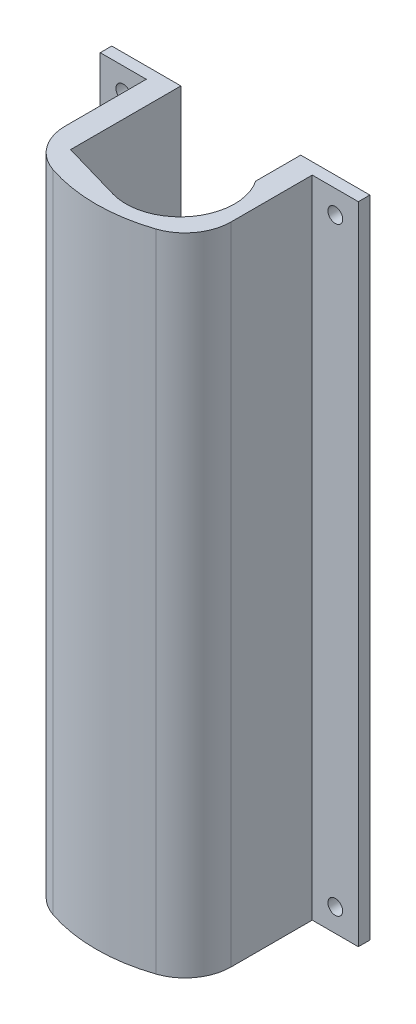
from build123d import *

# Parameters (mm, degrees)
BOSS_EXTRUDE1_DEPTH = 177.8
SKETCH2_R           = 2.032
CUT_EXTRUDE1_DEPTH  = 186.827403736
FILLET2_R           = 12.7


with BuildPart() as part:
    # Sketch1 → Boss-Extrude1 (new body)
    with BuildSketch(Plane(origin=(0, 0, 0), x_dir=(1, 0, 0), z_dir=(0, 1, 0))):
        with BuildLine():
            Line((-20.574, -9.652129604), (-4.162019583, -14.39674322))
            ThreePointArc((-4.162019583, -14.39674322), (12.103082443, -8.837647749), (12.446, 8.347796497))
            Line((12.446, 8.347796497), (12.446, 20.746712887))
            Line((12.446, 20.746712887), (31.496, 20.746712887))
            Line((31.496, 20.746712887), (31.496, 17.571712887))
            Line((31.496, 17.571712887), (18.796, 17.571712887))
            Line((18.796, 17.571712887), (18.796, -12.827129604))
            ThreePointArc((18.796, -12.827129604), (-4.064, -19.155968814), (-26.924, -12.827129604))
            Line((-26.924, -12.827129604), (-26.924, 17.571712887))
            Line((-26.924, 17.571712887), (-39.624, 17.571712887))
            Line((-39.624, 17.571712887), (-39.624, 20.746712887))
            Line((-39.624, 20.746712887), (-20.574, 20.746712887))
            Line((-20.574, 20.746712887), (-20.574, 9.652))
            Line((-20.574, 9.652), (-20.574, -9.652129604))
        make_face()
    extrude(amount=BOSS_EXTRUDE1_DEPTH)

    # Sketch2 → Cut-Extrude1 (cut, through all)
    with BuildSketch(Plane.XY.offset(-17.571712887)):
        with Locations((-33.274, 171.45)):
            Circle(SKETCH2_R)
        with Locations((-33.274, 6.35)):
            Circle(SKETCH2_R)
        with Locations((25.146, 171.45)):
            Circle(SKETCH2_R)
        with Locations((25.146, 6.35)):
            Circle(SKETCH2_R)
    extrude(amount=-CUT_EXTRUDE1_DEPTH, mode=Mode.SUBTRACT)

    # Fillet2
    fillet2_edges = [part.edges().sort_by_distance(p)[0] for p in [
        (18.796, 88.9, 12.827129604),
        (-26.924, 88.9, 12.827129604),
    ]]
    fillet(fillet2_edges, radius=FILLET2_R)


solid = part.part
